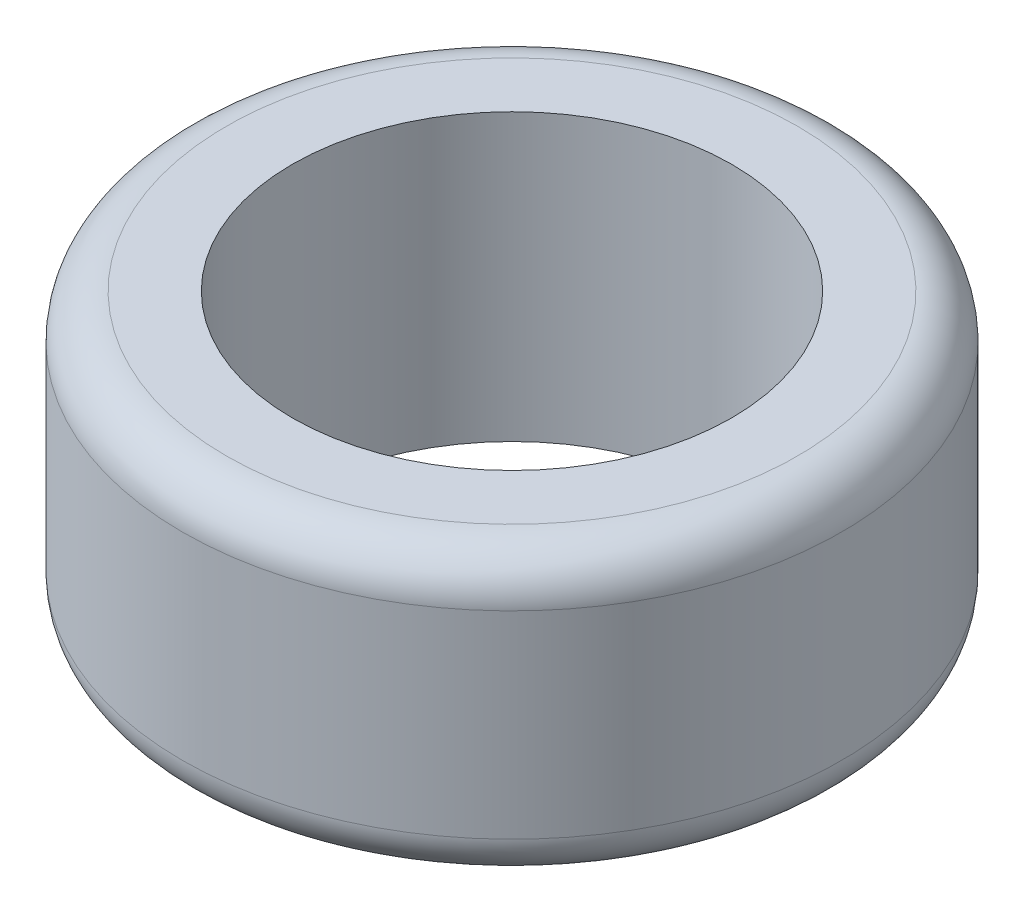
from build123d import *

# Parameters (mm, degrees)
SKETCH2_R           = 15
SKETCH2_R_2         = 10
BOSS_EXTRUDE1_DEPTH = 13
FILLET1_R           = 2


with BuildPart() as part:
    # Sketch2 → Boss-Extrude1 (new body)
    with BuildSketch(Plane(origin=(0, 0, 0), x_dir=(1, 0, 0), z_dir=(0, 1, 0))):
        with Locations(Location((0, 0, 0), (0, 0, 90))):
            Circle(SKETCH2_R)
        with Locations(Location((0, 0, 0), (0, 0, 90))):
            Circle(SKETCH2_R_2, mode=Mode.SUBTRACT)
    extrude(amount=BOSS_EXTRUDE1_DEPTH)

    # Fillet1
    fillet1_edges = [part.edges().sort_by_distance(p)[0] for p in [
        (0, 0, 15),
        (0, 13, 15),
    ]]
    fillet(fillet1_edges, radius=FILLET1_R)


solid = part.part
